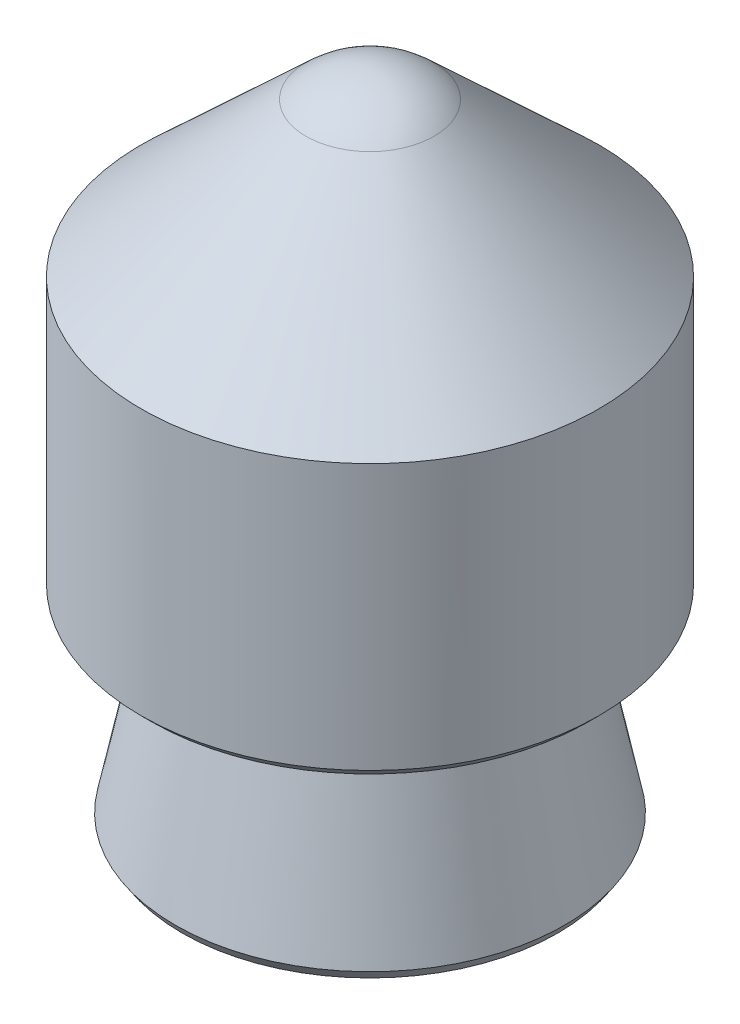
from build123d import *
from OCP.BRepFilletAPI import BRepFilletAPI_MakeChamfer

# Parameters (mm, degrees)
CHAMFER1_SIZE              = 0.254
CHAMFER1_SIZE2             = 0.215388858
SKETCH4_R                  = 3.5
CUT_EXTRUDE1_DEPTH         = 2.5
M7X0_75_TAPPED_HOLE1_D     = 6
M7X0_75_TAPPED_HOLE1_DEPTH = 10.954004
M7X0_75_TAPPED_HOLE1_TIP   = 1.802581857


with BuildPart() as part:
    # Sketch1 → Revolve1 (revolve)
    with BuildSketch(Plane.XY, mode=Mode.PRIVATE) as revolve1_sk:
        with BuildLine():
            Line((0, 25.4), (-4.80695, 25.4))
            Line((-4.80695, 25.4), (-3.8227, 30.2387))
            Line((-3.8227, 30.2387), (-5.588, 30.2387))
            Line((-5.588, 30.2387), (-5.588, 36.9824))
            Line((-5.588, 36.9824), (-1.563367534, 40.735379295))
            ThreePointArc((-1.563367534, 40.735379295), (-0.840141831, 41.19169557), (0, 41.3512))
            Line((0, 41.3512), (0, 25.4))
        make_face()
    revolve(revolve1_sk.sketch.rotate(Axis((0, 25.4, 0), (0, 1, 0)), 270), axis=Axis((0, 25.4, 0), (0, 1, 0)))

    # Chamfer1: one chamfer whose edges measure the first distance from different faces: ONE call of the kernel's chamfer builder (chamfer() names one face for all edges)
    chamfer1_edges_1 = [part.edges().sort_by_distance(p)[0] for p in [
        (0, 30.2387, 5.588),
    ]]
    chamfer1_edges_2 = [part.edges().sort_by_distance(p)[0] for p in [
        (0, 25.4, 4.80695),
    ]]
    chamfer1_side_2 = [part.faces().sort_by_distance(p)[0] for p in [
        (0, 27.81935, 4.314825),
    ]]
    chamfer1 = BRepFilletAPI_MakeChamfer(part.part.solid().wrapped)
    for e in chamfer1_edges_1:
        chamfer1.Add(CHAMFER1_SIZE, e.wrapped)
    for e in chamfer1_edges_2:
        chamfer1.Add(CHAMFER1_SIZE, CHAMFER1_SIZE2, e.wrapped, chamfer1_side_2[0].wrapped)  # the first distance lies on this face
    add(Compound.cast(chamfer1.Shape()), mode=Mode.REPLACE)

    # Sketch4 → Cut-Extrude1 (cut)
    with BuildSketch(Plane.XZ.offset(-25.4)):
        with Locations(Location((0, 0, 0), (0, 0, 270))):
            Circle(SKETCH4_R)
    extrude(amount=-CUT_EXTRUDE1_DEPTH, mode=Mode.SUBTRACT)

    # M7x0.75 Tapped Hole1
    with Locations(Plane(origin=(0, 25.4, 0), x_dir=(-1, 0, 0), z_dir=(0, -1, 0))):
        with Locations((0, 0), (96.139395676, -180.684699687)):
            Hole(M7X0_75_TAPPED_HOLE1_D / 2, depth=M7X0_75_TAPPED_HOLE1_DEPTH)
            with Locations((0, 0, -(M7X0_75_TAPPED_HOLE1_DEPTH + M7X0_75_TAPPED_HOLE1_TIP / 2))):  # 118° drill point
                Cone(0, M7X0_75_TAPPED_HOLE1_D / 2, M7X0_75_TAPPED_HOLE1_TIP, mode=Mode.SUBTRACT)


solid = part.part
